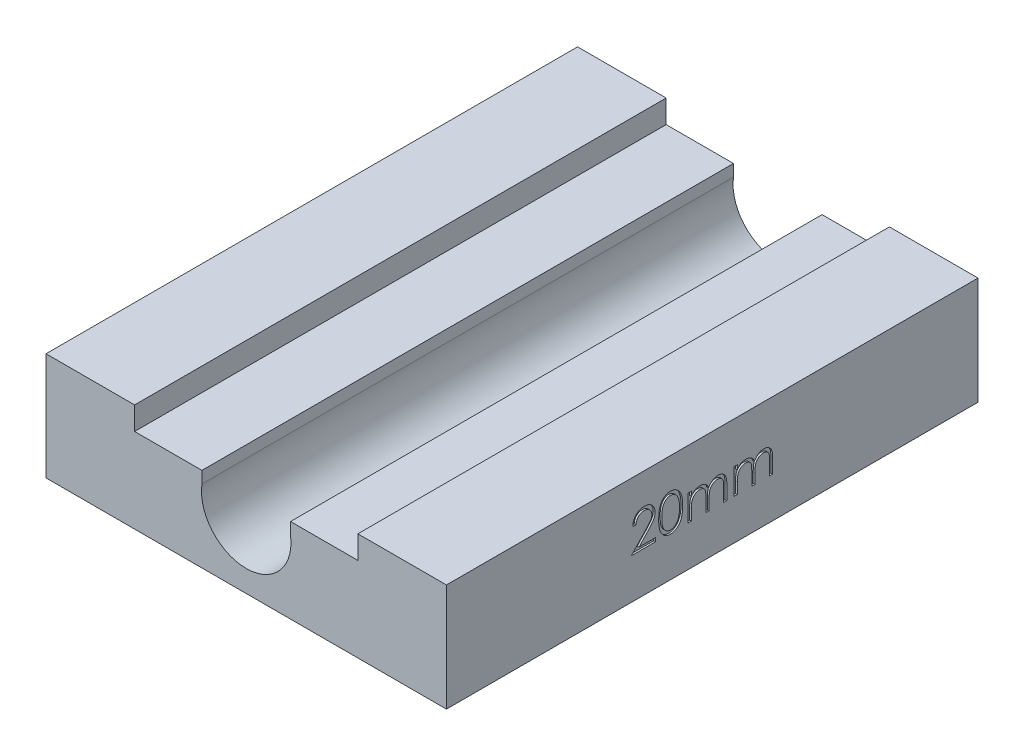
from build123d import *

# Parameters (mm, degrees)
BOSS_EXTRUDE1_DEPTH = 120
CUT_EXTRUDE1_DEPTH  = 0.4


with BuildPart() as part:
    # Sketch1 → Boss-Extrude1 (new body)
    with BuildSketch(Plane.XY):
        with BuildLine():
            ThreePointArc((10.1, 0), (-0.71063352, -10.074968983), (-10, 1.417744688))
            Line((-10, 1.417744688), (-10, 4.08355698))
            Line((-10, 4.08355698), (-25.2, 4.08355698))
            Line((-25.2, 4.08355698), (-25.2, 9.28355698))
            Line((-25.2, 9.28355698), (-45.2, 9.28355698))
            Line((-45.2, 9.28355698), (-45.2, -15))
            Line((-45.2, -15), (45.2, -15))
            Line((45.2, -15), (45.2, 9.28355698))
            Line((45.2, 9.28355698), (25.2, 9.28355698))
            Line((25.2, 9.28355698), (25.2, 4.08355698))
            Line((25.2, 4.08355698), (10, 4.08355698))
            Line((10, 4.08355698), (10, 1.417744688))
            ThreePointArc((10, 1.417744688), (10.074968983, 0.71063352), (10.1, 0))
        make_face()
    extrude(amount=BOSS_EXTRUDE1_DEPTH)

    # Sketch2 → Cut-Extrude1 (cut)
    # profile 1 of 4: a face of its own
    with BuildSketch(Plane(origin=(45.2, 0, 0), x_dir=(0, 0, -1), z_dir=(1, 0, 0))):
        with BuildLine():
            Line((-77.2182961, -0.33979267), (-77.936244818, -0.33979267))
            add(Edge.make_bspline(
                [(-77.936244818, -0.33979267), (-77.931565611, -0.244544927), (-77.922375774, -0.057480893), (-77.879339684, 0.215259464), (-77.817760536, 0.475956147), (-77.730694355, 0.72251595), (-77.622565721, 0.957118938), (-77.492897087, 1.17883326), (-77.339311143, 1.38681312), (-77.165124322, 1.579130476), (-76.975938861, 1.755559209), (-76.771810999, 1.90791405), (-76.55730808, 2.036640156), (-76.333080882, 2.144254423), (-76.096599594, 2.225031214), (-75.850010205, 2.28496639), (-75.592229322, 2.321026609), (-75.416594986, 2.32490269), (-75.327270459, 2.326873997)],
                knots=[0, 0, 0, 0, 1.10065271, 2.161652631, 3.183658789, 4.190468796, 5.17591951, 6.163126047, 7.15150782, 8.156236427, 9.156009102, 10.134482811, 11.092018607, 12.041330605, 13.001268258, 13.972401359, 14.968799086, 16, 16, 16, 16], degree=3))
            add(Edge.make_bspline(
                [(-75.327270459, 2.326873997), (-75.239549147, 2.324820382), (-75.067179902, 2.320785102), (-74.815609584, 2.286131321), (-74.576118625, 2.231855683), (-74.349175158, 2.15570616), (-74.136589868, 2.053341755), (-73.936765766, 1.930375952), (-73.747323913, 1.788159195), (-73.576794122, 1.620721907), (-73.420204226, 1.441973599), (-73.285113357, 1.251144105), (-73.169426127, 1.054048595), (-73.072997144, 0.849184134), (-73.002011684, 0.634621784), (-72.948118637, 0.41348532), (-72.917655977, 0.183485752), (-72.912980723, 0.027813625), (-72.910603793, -0.051331132)],
                knots=[0, 0, 0, 0, 1.111607364, 2.184268762, 3.212621178, 4.221274766, 5.211760367, 6.196651075, 7.1921475, 8.207485113, 9.220403448, 10.201281604, 11.166441695, 12.114753415, 13.065576456, 14.026450734, 14.996634279, 16, 16, 16, 16], degree=3))
            add(Edge.make_bspline(
                [(-72.910603793, -0.051331132), (-72.914458981, -0.162759267), (-72.922101705, -0.383660132), (-72.988057597, -0.708698663), (-73.089959532, -1.023910227), (-73.213555028, -1.277576632), (-73.33840204, -1.480952388), (-73.448527287, -1.649902425), (-73.580304093, -1.830077091), (-73.732526752, -2.023291055), (-73.902898881, -2.230135329), (-74.092646693, -2.450694794), (-74.3032197, -2.682626921), (-74.45100983, -2.841040207), (-74.527590972, -2.923126003)],
                knots=[0, 0, 0, 0, 1.184203166, 2.347625244, 3.513805382, 4.700623107, 5.337941753, 6.051866363, 6.845199593, 7.711357327, 8.668078039, 9.695487809, 10.805859518, 12, 12, 12, 12], degree=3))
            Line((-74.527590972, -2.923126003), (-76.529193536, -5.057741388))
            Line((-76.529193536, -5.057741388), (-72.80803969, -5.057741388))
            Line((-72.80803969, -5.057741388), (-72.80803969, -5.878254209))
            Line((-72.80803969, -5.878254209), (-78.243937126, -5.878254209))
            Line((-78.243937126, -5.878254209), (-75.141373023, -2.567356773))
            add(Edge.make_bspline(
                [(-75.141373023, -2.567356773), (-75.065834996, -2.488503501), (-74.920741906, -2.337042503), (-74.715524588, -2.115915737), (-74.5312069, -1.910773929), (-74.366595716, -1.722004676), (-74.22526199, -1.546846806), (-74.099839745, -1.390973198), (-73.999346966, -1.247534455), (-73.890283205, -1.081270194), (-73.784651247, -0.878270612), (-73.693880148, -0.630193608), (-73.638531922, -0.37481703), (-73.631892298, -0.202240946), (-73.628552511, -0.115433696)],
                knots=[0, 0, 0, 0, 1.329631726, 2.553950428, 3.673215718, 4.687767853, 5.603093632, 6.413772471, 7.123043292, 7.734684054, 8.834405432, 9.900288307, 10.943827018, 12, 12, 12, 12], degree=3))
            add(Edge.make_bspline(
                [(-73.628552511, -0.115433696), (-73.630005636, -0.060847642), (-73.632869467, 0.046730987), (-73.658144204, 0.204458436), (-73.696339646, 0.356606582), (-73.751071665, 0.503643426), (-73.823315642, 0.644090631), (-73.911254796, 0.778119157), (-74.012717798, 0.907693934), (-74.130092128, 1.029187187), (-74.259032745, 1.140458514), (-74.395248173, 1.239027852), (-74.539362697, 1.321402962), (-74.69076869, 1.388930956), (-74.849044049, 1.441903256), (-75.014494895, 1.47860858), (-75.186664075, 1.501654258), (-75.304226351, 1.504772365), (-75.364129434, 1.506361176)],
                knots=[0, 0, 0, 0, 0.991446411, 1.95395049, 2.89581595, 3.838931463, 4.798493298, 5.75982156, 6.748411868, 7.785213223, 8.824556874, 9.840280684, 10.836137867, 11.835679398, 12.848801643, 13.863922112, 14.911575587, 16, 16, 16, 16], degree=3))
            add(Edge.make_bspline(
                [(-75.364129434, 1.506361176), (-75.426691337, 1.504726817), (-75.549552586, 1.501517204), (-75.729938947, 1.479065401), (-75.902020724, 1.440332052), (-76.066230788, 1.387356796), (-76.222846984, 1.32002297), (-76.371107656, 1.236156125), (-76.510679974, 1.136079569), (-76.641826313, 1.02261544), (-76.762658266, 0.896289495), (-76.868822553, 0.755466722), (-76.961586014, 0.602718344), (-77.042521405, 0.438456514), (-77.108248697, 0.261190731), (-77.15847304, 0.071550263), (-77.198214404, -0.129641466), (-77.211491023, -0.268578803), (-77.2182961, -0.33979267)],
                knots=[0, 0, 0, 0, 1.031018746, 2.02475058, 2.990194455, 3.934040569, 4.864654155, 5.795059489, 6.735614925, 7.690564532, 8.649604399, 9.611025574, 10.590972636, 11.591080095, 12.624614302, 13.701020113, 14.821632451, 16, 16, 16, 16], degree=3))
        make_face()
    # profile 2 of 4: a face of its own
    with BuildSketch(Plane(origin=(45.2, 0, 0), x_dir=(0, 0, -1), z_dir=(1, 0, 0))):
        with BuildLine():
            add(Edge.make_bspline(
                [(-72.090090972, -1.881459337), (-72.089341216, -1.753236736), (-72.087884805, -1.504162486), (-72.0716827, -1.141226162), (-72.044767632, -0.800745501), (-72.007882208, -0.482704207), (-71.962995396, -0.187020174), (-71.903074284, 0.085516414), (-71.834930735, 0.336166943), (-71.755953716, 0.565748768), (-71.66683877, 0.777354946), (-71.569846174, 0.974898264), (-71.461126644, 1.158079823), (-71.3468937, 1.329823344), (-71.222523251, 1.487317504), (-71.091554587, 1.632786447), (-70.948876012, 1.762868162), (-70.799337708, 1.881373996), (-70.641585789, 1.985258503), (-70.480116838, 2.076761905), (-70.313819453, 2.15493303), (-70.142239606, 2.216396884), (-69.966919474, 2.267164534), (-69.787246179, 2.301882128), (-69.602923061, 2.32372649), (-69.478508353, 2.325814874), (-69.415411485, 2.326873997)],
                knots=[0, 0, 0, 0, 1.646270934, 3.197905019, 4.663502075, 6.030701355, 7.308322542, 8.50163776, 9.611534131, 10.641858119, 11.616356847, 12.558055219, 13.465016945, 14.349605745, 15.204443733, 16.039544428, 16.859896111, 17.680448484, 18.487036065, 19.28249412, 20.06191084, 20.843045899, 21.620316918, 22.403196591, 23.190181807, 24, 24, 24, 24], degree=3))
            add(Edge.make_bspline(
                [(-69.415411485, 2.326873997), (-69.351787534, 2.32575899), (-69.225259514, 2.323541594), (-69.038195799, 2.302229725), (-68.855453669, 2.266867158), (-68.677812209, 2.216762074), (-68.50381224, 2.154600527), (-68.334814737, 2.076687116), (-68.169769979, 1.985992563), (-68.011300751, 1.8794237), (-67.857667344, 1.760607069), (-67.712643429, 1.626292397), (-67.576215804, 1.477835896), (-67.446672249, 1.316825921), (-67.327688026, 1.140174299), (-67.214377324, 0.950953477), (-67.112955528, 0.745854357), (-67.01527627, 0.528299002), (-66.930963158, 0.292267782), (-66.854926026, 0.039091186), (-66.793488383, -0.234221241), (-66.742312904, -0.526235516), (-66.702667427, -0.838024049), (-66.673792817, -1.168918484), (-66.658540051, -1.51913652), (-66.655667591, -1.758583032), (-66.654193536, -1.881459337)],
                knots=[0, 0, 0, 0, 0.810914788, 1.612654377, 2.396697861, 3.181598691, 3.963628158, 4.749916497, 5.551656086, 6.361998678, 7.18212741, 8.025565596, 8.878627764, 9.750805457, 10.657531673, 11.591944965, 12.560506719, 13.57287815, 14.630710178, 15.753379473, 16.941251878, 18.199788006, 19.531962791, 20.947069417, 22.433333509, 24, 24, 24, 24], degree=3))
            add(Edge.make_bspline(
                [(-66.654193536, -1.881459337), (-66.655682872, -2.003799698), (-66.658584783, -2.242174902), (-66.673621827, -2.590817131), (-66.703241556, -2.919955516), (-66.740292957, -3.23037943), (-66.791609444, -3.520796845), (-66.854706967, -3.792212727), (-66.924764848, -4.045799176), (-67.011244377, -4.279478746), (-67.105897429, -4.496511255), (-67.208880735, -4.699179023), (-67.319211766, -4.889273406), (-67.439414612, -5.065272828), (-67.567536699, -5.228424044), (-67.706320216, -5.375847181), (-67.851852982, -5.511094431), (-68.005938504, -5.631441009), (-68.166879193, -5.736777705), (-68.331357083, -5.830980791), (-68.50229053, -5.906941237), (-68.675805851, -5.972164188), (-68.854384973, -6.021993792), (-69.037805295, -6.056448319), (-69.225133834, -6.080612544), (-69.351765983, -6.082455927), (-69.415411485, -6.083382414)],
                knots=[0, 0, 0, 0, 1.561518951, 3.042555995, 4.452378317, 5.7783523, 7.031515105, 8.214008947, 9.334062868, 10.386615937, 11.391082383, 12.354592575, 13.286541444, 14.194233754, 15.072674879, 15.931287219, 16.775624067, 17.606195743, 18.42308326, 19.229000347, 20.022332153, 20.807536673, 21.593273796, 22.3848459, 23.188221202, 24, 24, 24, 24], degree=3))
            add(Edge.make_bspline(
                [(-69.415411485, -6.083382414), (-69.478506603, -6.082316458), (-69.602917859, -6.080214602), (-69.78726626, -6.05846893), (-69.96619756, -6.02350778), (-70.140594712, -5.974555542), (-70.31135246, -5.914635917), (-70.476143973, -5.836570354), (-70.636801536, -5.746663911), (-70.792896521, -5.644274376), (-70.941495746, -5.526967672), (-71.083435415, -5.397220726), (-71.215149745, -5.251795786), (-71.337741963, -5.092989105), (-71.454254165, -4.922261694), (-71.561429875, -4.737282555), (-71.660563256, -4.53878516), (-71.751176949, -4.325487078), (-71.831516751, -4.094275815), (-71.902482941, -3.842506264), (-71.958515301, -3.567956238), (-72.006476342, -3.272830828), (-72.045160646, -2.955861844), (-72.071570532, -2.616877208), (-72.087893538, -2.256088159), (-72.089345128, -2.008614389), (-72.090090972, -1.881459337)],
                knots=[0, 0, 0, 0, 0.810891512, 1.598919785, 2.382837074, 3.152667961, 3.926044502, 4.706494248, 5.493654104, 6.291793342, 7.103789334, 7.925228297, 8.761435821, 9.622817696, 10.50288917, 11.416980706, 12.369136599, 13.353924996, 14.394355917, 15.514179734, 16.714354668, 17.994756427, 19.357759367, 20.818452758, 22.365282078, 24, 24, 24, 24], degree=3))
        make_face()
        with BuildLine():
            add(Edge.make_bspline(
                [(-71.372142254, -1.878254209), (-71.371869232, -1.985108377), (-71.371339351, -2.192491337), (-71.357496606, -2.493847362), (-71.338638933, -2.774922399), (-71.314315968, -3.03607334), (-71.278194943, -3.276416225), (-71.237722285, -3.497604072), (-71.188469509, -3.698466329), (-71.130195182, -3.880381325), (-71.063820104, -4.046436338), (-70.991349558, -4.200953401), (-70.913496477, -4.345757828), (-70.82636699, -4.479548932), (-70.731475417, -4.602763022), (-70.630965111, -4.717580924), (-70.521084918, -4.819974024), (-70.369076364, -4.942778264), (-70.168398708, -5.069679142), (-69.915551953, -5.18018449), (-69.655738351, -5.249630104), (-69.479392636, -5.258461547), (-69.391373023, -5.262869593)],
                knots=[0, 0, 0, 0, 1.459021318, 2.831673884, 4.118529203, 5.306027144, 6.411944654, 7.436330062, 8.375795394, 9.233974572, 10.042671642, 10.816086306, 11.563610507, 12.285937304, 12.993564865, 13.685989202, 14.367179055, 15.041617293, 16.353048772, 17.594441528, 18.799311195, 20, 20, 20, 20], degree=3))
            add(Edge.make_bspline(
                [(-69.391373023, -5.262869593), (-69.30278406, -5.259217523), (-69.125789035, -5.251920922), (-68.867197504, -5.181523808), (-68.616156886, -5.075307718), (-68.419421023, -4.94971342), (-68.269746638, -4.83010581), (-68.162507803, -4.728129471), (-68.064080264, -4.613944631), (-67.97072695, -4.49074624), (-67.885106205, -4.356180562), (-67.807247605, -4.210894676), (-67.736199953, -4.054485126), (-67.695722134, -3.945297151), (-67.67502687, -3.889472157)],
                knots=[0, 0, 0, 0, 1.353760809, 2.704726607, 4.075137775, 5.516104923, 6.260822281, 7.007110065, 7.778089737, 8.566572457, 9.372053459, 10.217411131, 11.088608312, 12, 12, 12, 12], degree=3))
            add(Edge.make_bspline(
                [(-67.67502687, -3.889472157), (-67.650908543, -3.818089896), (-67.601937997, -3.673153292), (-67.53882537, -3.448322087), (-67.489121601, -3.212430055), (-67.444405336, -2.966886931), (-67.413884066, -2.7098819), (-67.389317635, -2.442210166), (-67.374847494, -2.163669909), (-67.373053777, -1.974424215), (-67.372142254, -1.878254209)],
                knots=[0, 0, 0, 0, 0.884706709, 1.796334032, 2.740027952, 3.714592787, 4.726048262, 5.777819803, 6.87074269, 8, 8, 8, 8], degree=3))
            add(Edge.make_bspline(
                [(-67.372142254, -1.878254209), (-67.37339983, -1.782099757), (-67.375859916, -1.594001095), (-67.385263316, -1.318530967), (-67.409545772, -1.056890371), (-67.436515187, -0.807952148), (-67.476280264, -0.573094313), (-67.519155251, -0.350350758), (-67.576758022, -0.142480987), (-67.638288936, 0.053769485), (-67.708712697, 0.236170981), (-67.786234376, 0.405573922), (-67.869026967, 0.56279615), (-67.958952088, 0.707406302), (-68.054942221, 0.840052114), (-68.159530905, 0.958074044), (-68.268569471, 1.065129972), (-68.421294467, 1.18733013), (-68.621235701, 1.311928291), (-68.870025752, 1.426592885), (-69.128930082, 1.492440411), (-69.30395512, 1.501724267), (-69.391373023, 1.506361176)],
                knots=[0, 0, 0, 0, 1.31362396, 2.569729283, 3.763502607, 4.902122613, 5.988968491, 7.01645872, 7.998833611, 8.933434873, 9.825090667, 10.667526885, 11.477055099, 12.250526234, 12.991942729, 13.710640831, 14.402115721, 15.076753259, 16.378508321, 17.609869233, 18.806226677, 20, 20, 20, 20], degree=3))
            add(Edge.make_bspline(
                [(-69.391373023, 1.506361176), (-69.479854377, 1.501717869), (-69.656978275, 1.492422797), (-69.9185736, 1.426838218), (-70.169326404, 1.312522867), (-70.368738918, 1.186917444), (-70.52157043, 1.067287018), (-70.629188015, 0.963546552), (-70.730093551, 0.850069399), (-70.823048294, 0.725722165), (-70.910109513, 0.592087039), (-70.990066113, 0.44811272), (-71.062105724, 0.293069602), (-71.128584664, 0.127089178), (-71.187036751, -0.054810124), (-71.235251524, -0.255424966), (-71.279793359, -0.47590929), (-71.311325403, -0.71755388), (-71.339356844, -0.97877023), (-71.357371354, -1.260546958), (-71.371385657, -1.562408399), (-71.371885004, -1.770863618), (-71.372142254, -1.878254209)],
                knots=[0, 0, 0, 0, 1.207732386, 2.417664972, 3.655092373, 4.956220595, 5.625982001, 6.301752483, 6.994047911, 7.697131622, 8.419323945, 9.170223765, 9.943494443, 10.752040957, 11.610060368, 12.549350801, 13.567764191, 14.679664412, 15.874934091, 17.154273443, 18.533957287, 20, 20, 20, 20], degree=3))
        make_face(mode=Mode.SUBTRACT)
    # profile 3 of 4: a face of its own
    with BuildSketch(Plane(origin=(45.2, 0, 0), x_dir=(0, 0, -1), z_dir=(1, 0, 0))):
        with BuildLine():
            Line((-65.423424306, -0.032100362), (-64.705475588, -0.032100362))
            Line((-64.705475588, -0.032100362), (-64.705475588, -1.048126003))
            add(Edge.make_bspline(
                [(-64.705475588, -1.048126003), (-64.640826559, -0.959240057), (-64.516952823, -0.788926061), (-64.313831332, -0.564491126), (-64.110914503, -0.374026772), (-63.964781059, -0.274043066), (-63.894578152, -0.226010619)],
                knots=[0, 0, 0, 0, 1.134379233, 2.173579362, 3.122582517, 4, 4, 4, 4], degree=3))
            add(Edge.make_bspline(
                [(-63.894578152, -0.226010619), (-63.798887495, -0.18028407), (-63.60917801, -0.089629868), (-63.30879121, 0.002332553), (-63.001420537, 0.05884707), (-62.793858905, 0.066575924), (-62.689449947, 0.07046374)],
                knots=[0, 0, 0, 0, 1.014936303, 2.012140481, 3.000054389, 4, 4, 4, 4], degree=3))
            add(Edge.make_bspline(
                [(-62.689449947, 0.07046374), (-62.618837383, 0.068074504), (-62.479098917, 0.063346334), (-62.272049568, 0.03258054), (-62.071229884, -0.020599284), (-61.877826388, -0.094673168), (-61.695607693, -0.184379881), (-61.528546669, -0.289636356), (-61.378548479, -0.4078011), (-61.245688933, -0.544210089), (-61.126216875, -0.702693743), (-61.016322368, -0.887526312), (-60.914779026, -1.102858109), (-60.858501749, -1.259124488), (-60.828873023, -1.341395234)],
                knots=[0, 0, 0, 0, 1.009824226, 1.998387844, 2.986035974, 3.974953746, 4.955485308, 5.885931332, 6.793869504, 7.679848016, 8.601185859, 9.625726857, 10.749998409, 12, 12, 12, 12], degree=3))
            add(Edge.make_bspline(
                [(-60.828873023, -1.341395234), (-60.79753302, -1.284882276), (-60.735860296, -1.17367271), (-60.632304554, -1.016282397), (-60.523806733, -0.869066872), (-60.409442178, -0.731909331), (-60.28961455, -0.60548709), (-60.163759921, -0.489382172), (-60.032594707, -0.383095969), (-59.850212444, -0.258928747), (-59.612926484, -0.127040333), (-59.313753651, -0.012689604), (-59.002553258, 0.057975833), (-58.791312805, 0.066273599), (-58.684642254, 0.07046374)],
                knots=[0, 0, 0, 0, 0.86119277, 1.694706429, 2.50939023, 3.298075842, 4.073795165, 4.829715201, 5.57930267, 6.321991688, 7.768977793, 9.186738141, 10.579381044, 12, 12, 12, 12], degree=3))
            add(Edge.make_bspline(
                [(-58.684642254, 0.07046374), (-58.586627482, 0.066767235), (-58.394803056, 0.059532817), (-58.115540735, 0.002724877), (-57.855102323, -0.09482403), (-57.614011863, -0.227929485), (-57.396503718, -0.39519619), (-57.207437868, -0.594210676), (-57.047962752, -0.823565243), (-56.943783004, -1.03931836), (-56.873119543, -1.229799121), (-56.829551008, -1.392099215), (-56.791060276, -1.570731336), (-56.759103144, -1.765909077), (-56.735746453, -1.978321896), (-56.718441961, -2.207622183), (-56.706729793, -2.453988153), (-56.705902199, -2.623966439), (-56.705475588, -2.711587542)],
                knots=[0, 0, 0, 0, 1.209669288, 2.367440248, 3.500751976, 4.631527125, 5.755587489, 6.87532382, 8.007944318, 9.190864318, 9.82315674, 10.514484317, 11.263564316, 12.079023757, 12.955305781, 13.901327259, 14.918167583, 16, 16, 16, 16], degree=3))
            Line((-56.705475588, -2.711587542), (-56.705475588, -5.878254209))
            Line((-56.705475588, -5.878254209), (-57.423424306, -5.878254209))
            Line((-57.423424306, -5.878254209), (-57.423424306, -2.708382414))
            add(Edge.make_bspline(
                [(-57.423424306, -2.708382414), (-57.423602324, -2.63359253), (-57.423944448, -2.489857749), (-57.43010132, -2.283566432), (-57.441702038, -2.095524473), (-57.455266926, -1.925988271), (-57.474109919, -1.774562469), (-57.498443477, -1.641551226), (-57.524221032, -1.525908229), (-57.567046154, -1.397711549), (-57.635498478, -1.256293925), (-57.739767004, -1.103782894), (-57.871127246, -0.97102678), (-58.022807604, -0.855784913), (-58.195489764, -0.762085162), (-58.385809131, -0.695168568), (-58.592584106, -0.653744846), (-58.735721908, -0.64961681), (-58.809642254, -0.647484978)],
                knots=[0, 0, 0, 0, 1.253487763, 2.409012846, 3.458416907, 4.410876679, 5.259312806, 6.014470957, 6.676830364, 7.243083969, 8.276244668, 9.299465089, 10.325150304, 11.392391894, 12.482080715, 13.603491619, 14.762376348, 16, 16, 16, 16], degree=3))
            add(Edge.make_bspline(
                [(-58.809642254, -0.647484978), (-58.900316436, -0.650721909), (-59.07952309, -0.657119316), (-59.341112773, -0.722431025), (-59.592475096, -0.82090017), (-59.826109686, -0.963602929), (-60.04103035, -1.134593475), (-60.225943671, -1.337906836), (-60.378702952, -1.567918098), (-60.482140612, -1.780824846), (-60.547487586, -1.972069289), (-60.590634822, -2.139148997), (-60.624196859, -2.329049723), (-60.655672355, -2.540495417), (-60.676215733, -2.774941543), (-60.694886298, -3.031303602), (-60.703619699, -3.310352653), (-60.704841319, -3.503785084), (-60.705475588, -3.604215747)],
                knots=[0, 0, 0, 0, 1.090531906, 2.155305635, 3.229839962, 4.33261226, 5.44038871, 6.529323825, 7.629011124, 8.757537029, 9.370236727, 10.061839251, 10.834451254, 11.692844982, 12.636905849, 13.66920014, 14.789842145, 16, 16, 16, 16], degree=3))
            Line((-60.705475588, -3.604215747), (-60.705475588, -5.878254209))
            Line((-60.705475588, -5.878254209), (-61.423424306, -5.878254209))
            Line((-61.423424306, -5.878254209), (-61.423424306, -2.905497798))
            add(Edge.make_bspline(
                [(-61.423424306, -2.905497798), (-61.423605862, -2.821627355), (-61.423955159, -2.660269053), (-61.430072455, -2.428877795), (-61.441699019, -2.218406755), (-61.455140273, -2.029100552), (-61.474477823, -1.861303229), (-61.496442994, -1.714115211), (-61.522382675, -1.587905494), (-61.565330983, -1.4494749), (-61.630964053, -1.296969933), (-61.736537224, -1.134361885), (-61.868211693, -0.992034805), (-62.022659409, -0.870529094), (-62.196386683, -0.770091423), (-62.388348742, -0.697726276), (-62.596817114, -0.655613614), (-62.740537585, -0.650245621), (-62.814449947, -0.647484978)],
                knots=[0, 0, 0, 0, 1.320475261, 2.540461679, 3.643808994, 4.639130445, 5.527981419, 6.302341397, 6.981980563, 7.553956391, 8.582137848, 9.585246428, 10.591171744, 11.620968678, 12.668337649, 13.738356861, 14.836885341, 16, 16, 16, 16], degree=3))
            add(Edge.make_bspline(
                [(-62.814449947, -0.647484978), (-62.901344144, -0.650983172), (-63.074521194, -0.657954949), (-63.328925696, -0.720707575), (-63.574607259, -0.819002603), (-63.80764657, -0.955367904), (-64.021758909, -1.124280084), (-64.209206377, -1.322942702), (-64.366789293, -1.54888335), (-64.471319156, -1.759545102), (-64.538744239, -1.945998302), (-64.583533576, -2.104514754), (-64.622024149, -2.280515322), (-64.650627627, -2.474543004), (-64.678240006, -2.685334076), (-64.691566426, -2.913938624), (-64.704529997, -3.160160539), (-64.705152659, -3.330154928), (-64.705475588, -3.418318311)],
                knots=[0, 0, 0, 0, 1.098833095, 2.189935336, 3.297829714, 4.440610912, 5.596351641, 6.740013378, 7.886572111, 9.072425424, 9.705826452, 10.395263256, 11.156850408, 11.985370555, 12.878090359, 13.847760091, 14.883794034, 16, 16, 16, 16], degree=3))
            Line((-64.705475588, -3.418318311), (-64.705475588, -5.878254209))
            Line((-64.705475588, -5.878254209), (-65.423424306, -5.878254209))
            Line((-65.423424306, -5.878254209), (-65.423424306, -0.032100362))
        make_face()
    # profile 4 of 4: a face of its own
    with BuildSketch(Plane(origin=(45.2, 0, 0), x_dir=(0, 0, -1), z_dir=(1, 0, 0))):
        with BuildLine():
            Line((-55.064449947, -0.032100362), (-54.346501229, -0.032100362))
            Line((-54.346501229, -0.032100362), (-54.346501229, -1.048126003))
            add(Edge.make_bspline(
                [(-54.346501229, -1.048126003), (-54.2818522, -0.959240057), (-54.157978464, -0.788926061), (-53.954856973, -0.564491126), (-53.751940144, -0.374026772), (-53.6058067, -0.274043066), (-53.535603793, -0.226010619)],
                knots=[0, 0, 0, 0, 1.134379233, 2.173579362, 3.122582517, 4, 4, 4, 4], degree=3))
            add(Edge.make_bspline(
                [(-53.535603793, -0.226010619), (-53.439913136, -0.18028407), (-53.250203651, -0.089629868), (-52.949816851, 0.002332553), (-52.642446178, 0.05884707), (-52.434884546, 0.066575924), (-52.330475588, 0.07046374)],
                knots=[0, 0, 0, 0, 1.014936303, 2.012140481, 3.000054389, 4, 4, 4, 4], degree=3))
            add(Edge.make_bspline(
                [(-52.330475588, 0.07046374), (-52.259863024, 0.068074504), (-52.120124558, 0.063346334), (-51.913075209, 0.03258054), (-51.712255525, -0.020599284), (-51.518852029, -0.094673168), (-51.336633334, -0.184379881), (-51.16957231, -0.289636356), (-51.01957412, -0.4078011), (-50.886714574, -0.544210089), (-50.767242516, -0.702693743), (-50.657348009, -0.887526312), (-50.555804667, -1.102858109), (-50.49952739, -1.259124488), (-50.469898665, -1.341395234)],
                knots=[0, 0, 0, 0, 1.009824226, 1.998387844, 2.986035974, 3.974953746, 4.955485308, 5.885931332, 6.793869504, 7.679848016, 8.601185859, 9.625726857, 10.749998409, 12, 12, 12, 12], degree=3))
            add(Edge.make_bspline(
                [(-50.469898665, -1.341395234), (-50.438558661, -1.284882276), (-50.376885937, -1.17367271), (-50.273330195, -1.016282397), (-50.164832374, -0.869066872), (-50.050467819, -0.731909331), (-49.930640192, -0.60548709), (-49.804785562, -0.489382172), (-49.673620348, -0.383095969), (-49.491238085, -0.258928747), (-49.253952125, -0.127040333), (-48.954779292, -0.012689604), (-48.643578899, 0.057975833), (-48.432338446, 0.066273599), (-48.325667895, 0.07046374)],
                knots=[0, 0, 0, 0, 0.86119277, 1.694706429, 2.50939023, 3.298075842, 4.073795165, 4.829715201, 5.57930267, 6.321991688, 7.768977793, 9.186738141, 10.579381044, 12, 12, 12, 12], degree=3))
            add(Edge.make_bspline(
                [(-48.325667895, 0.07046374), (-48.227653123, 0.066767235), (-48.035828697, 0.059532817), (-47.756566376, 0.002724877), (-47.496127964, -0.09482403), (-47.255037504, -0.227929485), (-47.037529359, -0.39519619), (-46.848463509, -0.594210676), (-46.688988393, -0.823565243), (-46.584808645, -1.03931836), (-46.514145184, -1.229799121), (-46.470576649, -1.392099215), (-46.432085917, -1.570731336), (-46.400128785, -1.765909077), (-46.376772094, -1.978321896), (-46.359467602, -2.207622183), (-46.347755434, -2.453988153), (-46.34692784, -2.623966439), (-46.346501229, -2.711587542)],
                knots=[0, 0, 0, 0, 1.209669288, 2.367440248, 3.500751976, 4.631527125, 5.755587489, 6.87532382, 8.007944318, 9.190864318, 9.82315674, 10.514484317, 11.263564316, 12.079023757, 12.955305781, 13.901327259, 14.918167583, 16, 16, 16, 16], degree=3))
            Line((-46.346501229, -2.711587542), (-46.346501229, -5.878254209))
            Line((-46.346501229, -5.878254209), (-47.064449947, -5.878254209))
            Line((-47.064449947, -5.878254209), (-47.064449947, -2.708382414))
            add(Edge.make_bspline(
                [(-47.064449947, -2.708382414), (-47.064627965, -2.63359253), (-47.064970089, -2.489857749), (-47.071126961, -2.283566432), (-47.082727679, -2.095524473), (-47.096292567, -1.925988271), (-47.11513556, -1.774562469), (-47.139469118, -1.641551226), (-47.165246673, -1.525908229), (-47.208071795, -1.397711549), (-47.276524119, -1.256293925), (-47.380792645, -1.103782894), (-47.512152887, -0.97102678), (-47.663833245, -0.855784913), (-47.836515405, -0.762085162), (-48.026834772, -0.695168568), (-48.233609747, -0.653744846), (-48.376747549, -0.64961681), (-48.450667895, -0.647484978)],
                knots=[0, 0, 0, 0, 1.253487763, 2.409012846, 3.458416907, 4.410876679, 5.259312806, 6.014470957, 6.676830364, 7.243083969, 8.276244668, 9.299465089, 10.325150304, 11.392391894, 12.482080715, 13.603491619, 14.762376348, 16, 16, 16, 16], degree=3))
            add(Edge.make_bspline(
                [(-48.450667895, -0.647484978), (-48.541342077, -0.650721909), (-48.720548731, -0.657119316), (-48.982138414, -0.722431025), (-49.233500737, -0.82090017), (-49.467135327, -0.963602929), (-49.682055991, -1.134593475), (-49.866969312, -1.337906836), (-50.019728593, -1.567918098), (-50.123166253, -1.780824846), (-50.188513227, -1.972069289), (-50.231660463, -2.139148997), (-50.2652225, -2.329049723), (-50.296697996, -2.540495417), (-50.317241374, -2.774941543), (-50.335911939, -3.031303602), (-50.34464534, -3.310352653), (-50.34586696, -3.503785084), (-50.346501229, -3.604215747)],
                knots=[0, 0, 0, 0, 1.090531906, 2.155305635, 3.229839962, 4.33261226, 5.44038871, 6.529323825, 7.629011124, 8.757537029, 9.370236727, 10.061839251, 10.834451254, 11.692844982, 12.636905849, 13.66920014, 14.789842145, 16, 16, 16, 16], degree=3))
            Line((-50.346501229, -3.604215747), (-50.346501229, -5.878254209))
            Line((-50.346501229, -5.878254209), (-51.064449947, -5.878254209))
            Line((-51.064449947, -5.878254209), (-51.064449947, -2.905497798))
            add(Edge.make_bspline(
                [(-51.064449947, -2.905497798), (-51.064631503, -2.821627355), (-51.0649808, -2.660269053), (-51.071098096, -2.428877795), (-51.08272466, -2.218406755), (-51.096165914, -2.029100552), (-51.115503464, -1.861303229), (-51.137468635, -1.714115211), (-51.163408316, -1.587905494), (-51.206356624, -1.4494749), (-51.271989694, -1.296969933), (-51.377562865, -1.134361885), (-51.509237334, -0.992034805), (-51.66368505, -0.870529094), (-51.837412324, -0.770091423), (-52.029374383, -0.697726276), (-52.237842755, -0.655613614), (-52.381563226, -0.650245621), (-52.455475588, -0.647484978)],
                knots=[0, 0, 0, 0, 1.320475261, 2.540461679, 3.643808994, 4.639130445, 5.527981419, 6.302341397, 6.981980563, 7.553956391, 8.582137848, 9.585246428, 10.591171744, 11.620968678, 12.668337649, 13.738356861, 14.836885341, 16, 16, 16, 16], degree=3))
            add(Edge.make_bspline(
                [(-52.455475588, -0.647484978), (-52.542369785, -0.650983172), (-52.715546835, -0.657954949), (-52.969951337, -0.720707575), (-53.2156329, -0.819002603), (-53.448672211, -0.955367904), (-53.66278455, -1.124280084), (-53.850232019, -1.322942702), (-54.007814934, -1.54888335), (-54.112344797, -1.759545102), (-54.17976988, -1.945998302), (-54.224559217, -2.104514754), (-54.26304979, -2.280515322), (-54.291653268, -2.474543004), (-54.319265647, -2.685334076), (-54.332592067, -2.913938624), (-54.345555638, -3.160160539), (-54.3461783, -3.330154928), (-54.346501229, -3.418318311)],
                knots=[0, 0, 0, 0, 1.098833095, 2.189935336, 3.297829714, 4.440610912, 5.596351641, 6.740013378, 7.886572111, 9.072425424, 9.705826452, 10.395263256, 11.156850408, 11.985370555, 12.878090359, 13.847760091, 14.883794034, 16, 16, 16, 16], degree=3))
            Line((-54.346501229, -3.418318311), (-54.346501229, -5.878254209))
            Line((-54.346501229, -5.878254209), (-55.064449947, -5.878254209))
            Line((-55.064449947, -5.878254209), (-55.064449947, -0.032100362))
        make_face()
    extrude(amount=-CUT_EXTRUDE1_DEPTH, mode=Mode.SUBTRACT)


solid = part.part
